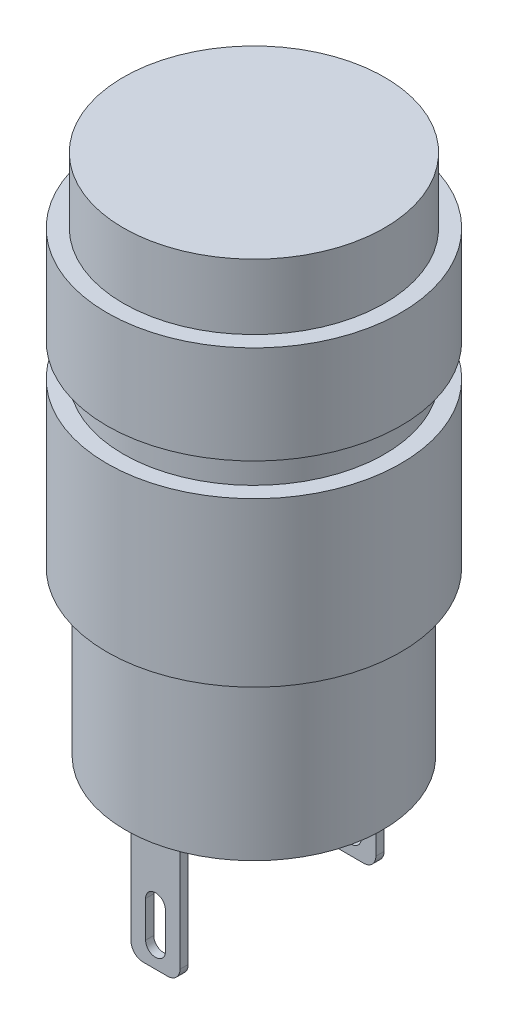
from build123d import *

# Parameters (mm, degrees)
SKETCH2_R           = 7.875
BOSS_EXTRUDE1_DEPTH = 22
BOSS_EXTRUDE2_START = 22
SKETCH4_R           = 9
BOSS_EXTRUDE2_DEPTH = 6
BOSS_EXTRUDE3_START = 28
SKETCH5_R           = 8
BOSS_EXTRUDE3_DEPTH = 4
SKETCH6_W           = 3
SKETCH6_H           = 0.5
BOSS_EXTRUDE4_DEPTH = 8
FILLET2_R           = 0.75
CUT_EXTRUDE1_DEPTH  = 37.534860886
BOSS_EXTRUDE5_START = 10
SKETCH11_R          = 9
SKETCH11_R_2        = 8
BOSS_EXTRUDE5_DEPTH = 10


with BuildPart() as part:
    # Sketch2 → Boss-Extrude1 (new body)
    with BuildSketch(Plane(origin=(0, 0, 0), x_dir=(1, 0, 0), z_dir=(0, 1, 0))):
        with Locations(Location((0, 0, 0), (0, 0, 270))):
            Circle(SKETCH2_R)
    extrude(amount=BOSS_EXTRUDE1_DEPTH)

    # Sketch4 → Boss-Extrude2 (add)
    with BuildSketch(Plane(origin=(0, 0, 0), x_dir=(1, 0, 0), z_dir=(0, 1, 0)).offset(BOSS_EXTRUDE2_START)):
        with Locations(Location((0, 0, 0), (0, 0, 270))):
            Circle(SKETCH4_R)
    extrude(amount=BOSS_EXTRUDE2_DEPTH)

    # Sketch5 → Boss-Extrude3 (add)
    with BuildSketch(Plane(origin=(0, 0, 0), x_dir=(1, 0, 0), z_dir=(0, 1, 0)).offset(BOSS_EXTRUDE3_START)):
        with Locations(Location((0, 0, 0), (0, 0, 270))):
            Circle(SKETCH5_R)
    extrude(amount=BOSS_EXTRUDE3_DEPTH)

    # Sketch6 → Boss-Extrude4 (add)
    with BuildSketch(Plane(origin=(0, 0, 0), x_dir=(1, 0, 0), z_dir=(0, 1, 0))):
        with Locations((0.3104886, 5.909025693)):
            Rectangle(SKETCH6_W, SKETCH6_H)
        with Locations((0.3104886, -6.090974307)):
            Rectangle(SKETCH6_W, SKETCH6_H)
    extrude(amount=-BOSS_EXTRUDE4_DEPTH)

    # Fillet2
    fillet2_edges = [part.edges().sort_by_distance(p)[0] for p in [
        (1.8104886, -8, -5.909025693),
        (-1.1895114, -8, -5.909025693),
        (1.8104886, -8, 6.090974307),
        (-1.1895114, -8, 6.090974307),
    ]]
    fillet(fillet2_edges, radius=FILLET2_R)

    # Sketch7 → Cut-Extrude1 (cut, through all)
    with BuildSketch(Plane.XY.offset(-6.159025693)):
        with BuildLine():
            Line((-0.296359001, -6.760155081), (-0.296359001, -4.547883008))
            ThreePointArc((-0.296359001, -4.547883008), (0.3104886, -3.941035407), (0.917336202, -4.547883008))
            Line((0.917336202, -4.547883008), (0.917336202, -6.760155081))
            ThreePointArc((0.917336202, -6.760155081), (0.3104886, -7.367002682), (-0.296359001, -6.760155081))
        make_face()
    extrude(amount=CUT_EXTRUDE1_DEPTH, mode=Mode.SUBTRACT)


with BuildPart() as body_2:
    # Sketch11 → Boss-Extrude5 (new body)
    with BuildSketch(Plane(origin=(0, 0, 0), x_dir=(1, 0, 0), z_dir=(0, 1, 0)).offset(BOSS_EXTRUDE5_START)):
        with Locations(Location((0, 0, 0), (0, 0, 270))):
            Circle(SKETCH11_R)
        with Locations(Location((0, 0, 0), (0, 0, 270))):
            Circle(SKETCH11_R_2, mode=Mode.SUBTRACT)
    extrude(amount=BOSS_EXTRUDE5_DEPTH)


solid = Compound([part.part, body_2.part])
